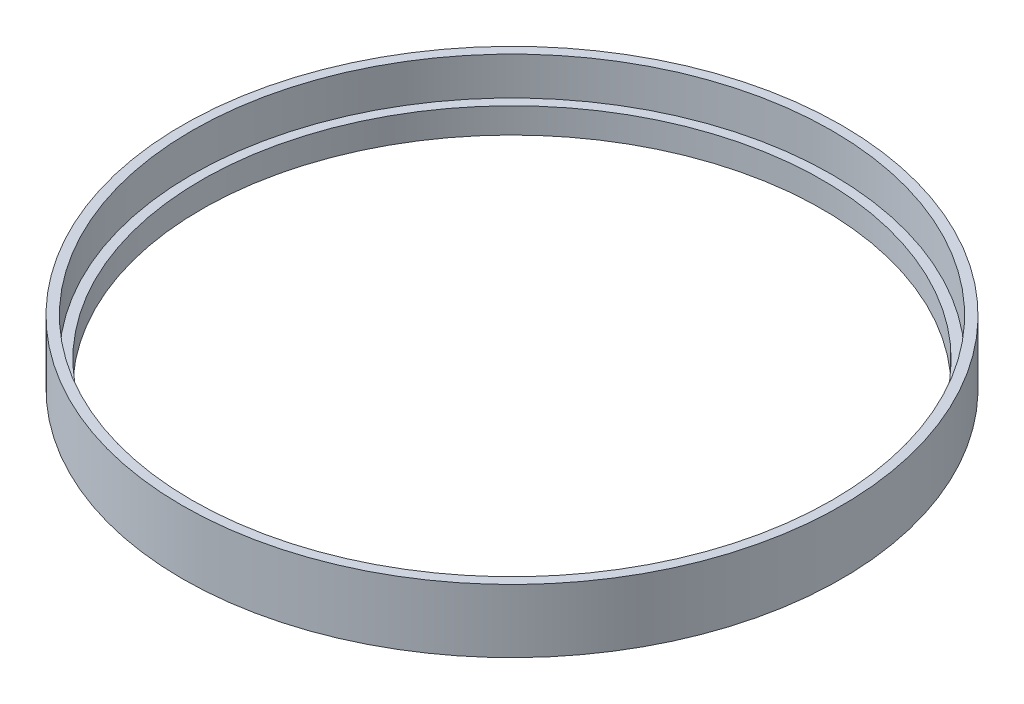
from build123d import *

# Parameters (mm, degrees)
CROQUIS1_R              = 26
SALIENTE_EXTRUIR1_DEPTH = 5
CROQUIS2_R              = 25.25
CORTAR_EXTRUIR1_DEPTH   = 3
CROQUIS3_R              = 24.5
CORTAR_EXTRUIR2_DEPTH   = 3


with BuildPart() as part:
    # Croquis1 → Saliente-Extruir1 (new body)
    with BuildSketch(Plane(origin=(0, 0, 0), x_dir=(1, 0, 0), z_dir=(0, 1, 0))):
        with Locations(Location((0, 0, 0), (0, 0, 270))):
            Circle(CROQUIS1_R)
    extrude(amount=SALIENTE_EXTRUIR1_DEPTH)

    # Croquis2 → Cortar-Extruir1 (cut)
    with BuildSketch(Plane(origin=(0, 5, 0), x_dir=(1, 0, 0), z_dir=(0, 1, 0))):
        with Locations(Location((0, 0, 0), (0, 0, 270))):
            Circle(CROQUIS2_R)
    extrude(amount=-CORTAR_EXTRUIR1_DEPTH, mode=Mode.SUBTRACT)

    # Croquis3 → Cortar-Extruir2 (cut)
    with BuildSketch(Plane(origin=(0, 2, 0), x_dir=(1, 0, 0), z_dir=(0, 1, 0))):
        with Locations(Location((0, 0, 0), (0, 0, 270))):
            Circle(CROQUIS3_R)
    extrude(amount=-CORTAR_EXTRUIR2_DEPTH, mode=Mode.SUBTRACT)


solid = part.part
